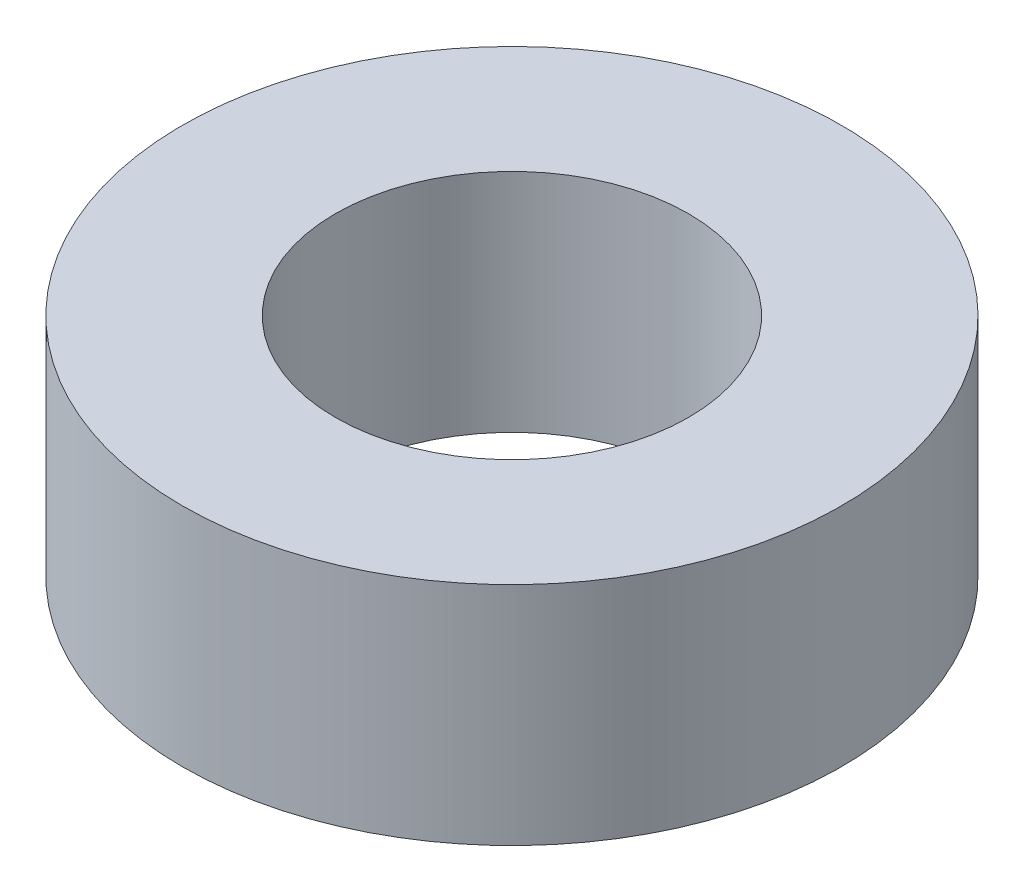
from build123d import *

# Parameters (mm, degrees)
SKETCH1_R        = 7
SKETCH1_R_2      = 3.75
EXTRUSION1_DEPTH = 4.8


with BuildPart() as part:
    # Sketch1 → Extrusion1 (new body)
    with BuildSketch(Plane(origin=(0, 0, 0), x_dir=(-1, 0, 0), z_dir=(0, 1, 0))):
        with Locations(Location((0, 0, 0), (0, 0, 90))):
            Circle(SKETCH1_R)
        with Locations(Location((0, 0, 0), (0, 0, 90))):
            Circle(SKETCH1_R_2, mode=Mode.SUBTRACT)
    extrude(amount=EXTRUSION1_DEPTH)


solid = part.part
